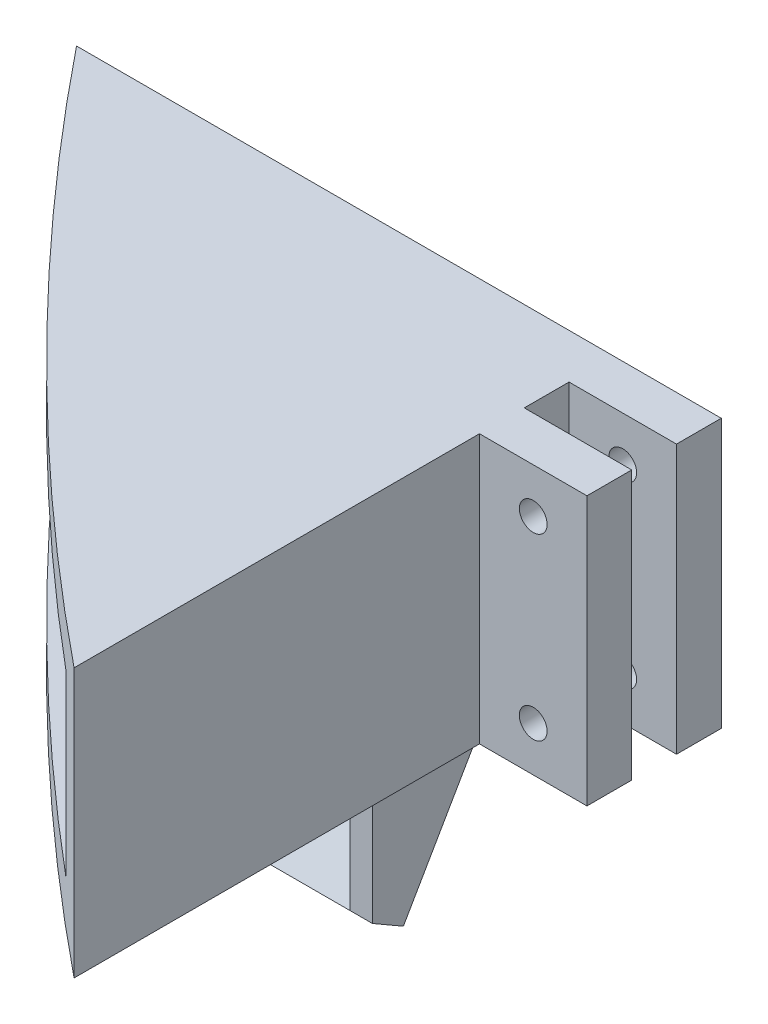
from build123d import *

# Parameters (mm, degrees)
EXTRUDE_1_DEPTH          = 30
CUT_EXTRUDE_1_DEPTH      = 98.124713642
CUT_EXTRUDE_1_DEPTH_BACK = 98.124713642
SKETCH_2_R               = 1.55
CUT_EXTRUDE_6_DEPTH      = 10
EXTRUDE_3_DEPTH          = 12.5
SKETCH_12_W              = 5
SKETCH_12_H              = 30
EXTRUDE_4_DEPTH          = 2
SKETCH_24_W              = 22
SKETCH_24_H              = 27
SKETCH_24_R              = 1.55
EXTRUDE_8_DEPTH          = 4
EXTRUDE_9_DEPTH          = 2.5
EXTRUDE_10_DEPTH         = 2.5


with BuildPart() as part:
    # 草图1 → 凸台-拉伸1 (new body)
    with BuildSketch(Plane(origin=(0, 0, 0), x_dir=(1, 0, 0), z_dir=(0, 1, 0))):
        with BuildLine():
            Line((0, 0), (-70, 0))
            ThreePointArc((-70, 0), (-41.606545869, -31.737243891), (-10, -60.276114672))
            Line((-10, -60.276114672), (-10, -15))
            Line((-10, -15), (0, -15))
            Line((0, -15), (0, -10))
            Line((0, -10), (-10, -10))
            Line((-10, -10), (-10, -5))
            Line((-10, -5), (0, -5))
            Line((0, -5), (0, 0))
        make_face()
    extrude(amount=EXTRUDE_1_DEPTH)

    # 草图2 → 切除-拉伸1 (cut, two sides: drawn at the far end of the back side and taken through both)
    with BuildSketch(Plane(origin=(0, 0, 0), x_dir=(-1, 0, 0), z_dir=(0, 0, -1)).offset(-CUT_EXTRUDE_1_DEPTH_BACK)):
        with Locations((4, 25)):
            Circle(SKETCH_2_R)
        with Locations((4, 5)):
            Circle(SKETCH_2_R)
    extrude(amount=CUT_EXTRUDE_1_DEPTH + CUT_EXTRUDE_1_DEPTH_BACK, mode=Mode.SUBTRACT)

    # 草图9 → 切除-拉伸6 (cut, symmetric)
    with BuildSketch(Plane(origin=(0, 15, 0), x_dir=(1, 0, 0), z_dir=(0, 1, 0))):
        with BuildLine():
            Line((-65.918016471, -5), (-59.391772218, -5))
            Line((-59.391772218, -5), (-15, -5))
            Line((-15, -5), (-15, -15))
            Line((-15, -15), (-15, -49.60330608))
            Line((-15, -49.60330608), (-15, -56.155472209))
            ThreePointArc((-15, -56.155472209), (-41.615194331, -31.728555364), (-65.918016471, -5))
        make_face()
    extrude(amount=CUT_EXTRUDE_6_DEPTH, both=True, mode=Mode.SUBTRACT)

    # 草图11 → 凸台-拉伸3 (add, symmetric)
    with BuildSketch(Plane(origin=(0, 15, 0), x_dir=(1, 0, 0), z_dir=(0, 1, 0))):
        Polygon((-15, -5), (-23, -5), (-15, -10), align=None)
    extrude(amount=EXTRUDE_3_DEPTH, both=True)

    # 草图12 → 凸台-拉伸4 (add)
    with BuildSketch(Plane(origin=(0, 0, 0), x_dir=(0, 0, -1), z_dir=(1, 0, 0))):
        with Locations((-12.5, 15)):
            Rectangle(SKETCH_12_W, SKETCH_12_H)
        with Locations((-2.5, 15)):
            Rectangle(SKETCH_12_W, SKETCH_12_H)
    extrude(amount=EXTRUDE_4_DEPTH)

    # 草图24 → 凸台-拉伸8 (add)
    with BuildSketch(Plane(origin=(0, 0, 0), x_dir=(-1, 0, 0), z_dir=(0, -0.500000000000001, -0.866025403784438))):
        with Locations((31, -13.5)):
            Rectangle(SKETCH_24_W, SKETCH_24_H)
        with Locations(Location((33, -23.660254038, 0), (0, 0, 90))):
            Circle(SKETCH_24_R, mode=Mode.SUBTRACT)
        with Locations(Location((36.660254038, -20, 0), (0, 0, 90))):
            Circle(SKETCH_24_R, mode=Mode.SUBTRACT)
        with Locations(Location((38, -15, 0), (0, 0, 90))):
            Circle(SKETCH_24_R, mode=Mode.SUBTRACT)
        with Locations(Location((36.660254038, -10, 0), (0, 0, 90))):
            Circle(SKETCH_24_R, mode=Mode.SUBTRACT)
        with Locations(Location((33, -6.339745962, 0), (0, 0, 90))):
            Circle(SKETCH_24_R, mode=Mode.SUBTRACT)
        with Locations(Location((28, -15, 0), (0, 0, 90))):
            Circle(SKETCH_24_R, mode=Mode.SUBTRACT)
    extrude(amount=-EXTRUDE_8_DEPTH)

    # 草图25 → 凸台-拉伸9 (add)
    with BuildSketch(Plane(origin=(-20, 0, 0), x_dir=(0, 0, -1), z_dir=(1, 0, 0))):
        Polygon((-16.964101615, -21.382685902), (-16.964101615, 0), (-4.618802154, 0), align=None)
    extrude(amount=-EXTRUDE_9_DEPTH)

    # 草图27 → 凸台-拉伸10 (add)
    with BuildSketch(Plane.ZY.offset(42)):
        Polygon((0, 0), (16.964101615, 0), (16.964101615, -21.382685902), (13.5, -23.382685902), align=None)
    extrude(amount=EXTRUDE_10_DEPTH)


solid = part.part
